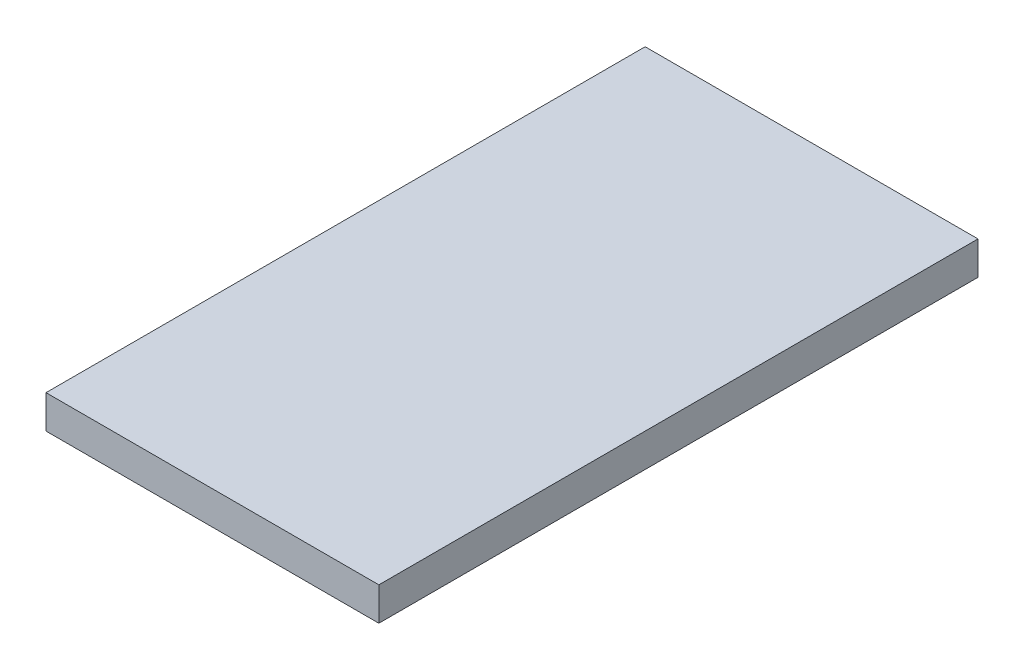
from build123d import *

# Parameters (mm, degrees)
SKETCH1_W           = 100
SKETCH1_H           = 180
BOSS_EXTRUDE1_DEPTH = 10


with BuildPart() as part:
    # Sketch1 → Boss-Extrude1 (new body)
    with BuildSketch(Plane(origin=(0, 0, 0), x_dir=(1, 0, 0), z_dir=(0, 1, 0))):
        Rectangle(SKETCH1_W, SKETCH1_H)
    extrude(amount=BOSS_EXTRUDE1_DEPTH)


solid = part.part
